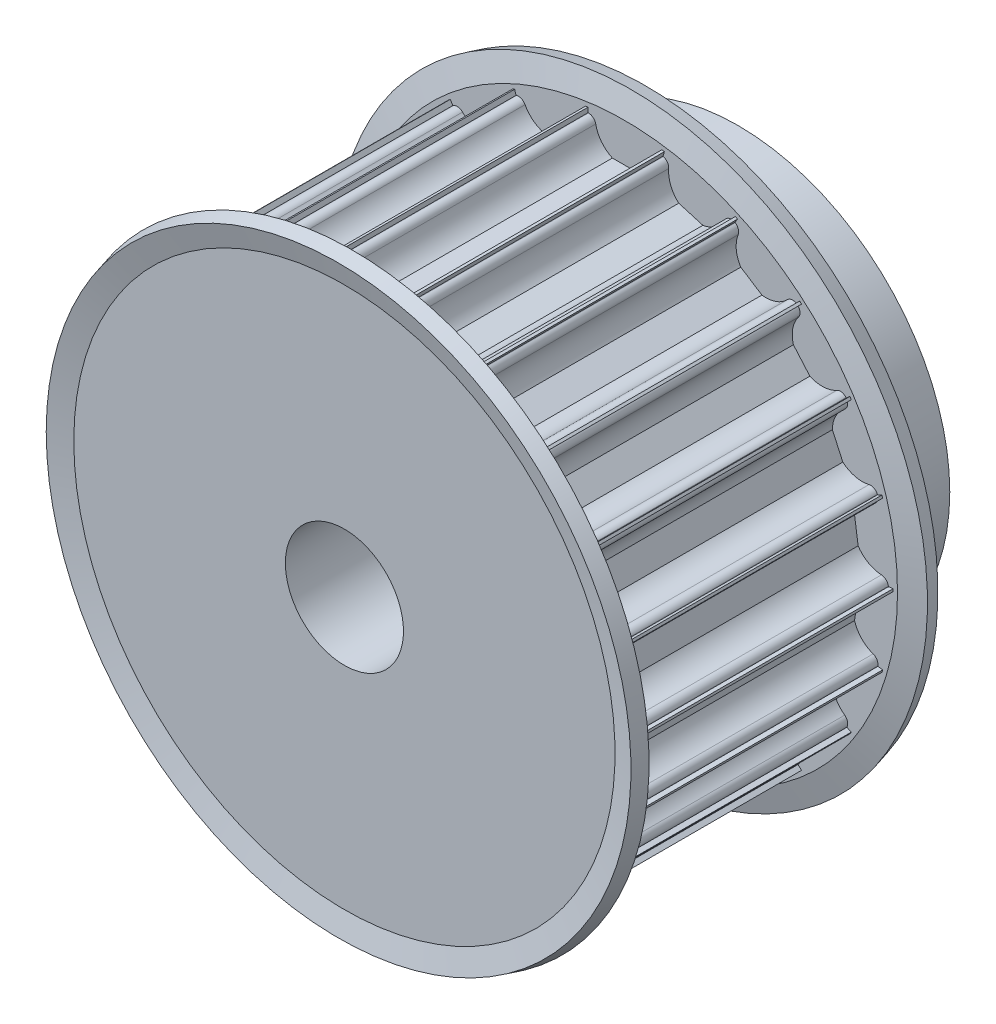
from build123d import *

# Parameters (mm, degrees)
CUT_EXTRUDE1_DEPTH = 48
CIRPATTERN1_COUNT  = 22


with BuildPart() as part:
    # Sketch1 → Revolve1 (revolve)
    with BuildSketch(Plane(origin=(0, 0, 0), x_dir=(0, 0, -1), z_dir=(1, 0, 0)), mode=Mode.PRIVATE) as revolve1_sk:
        Polygon((0, 6), (0, 27.25), (30, 27.25), (30, 21.5), (40, 21.5), (40, 6), align=None)
    revolve(revolve1_sk.sketch.rotate(Axis((0, 0, -88.99), (0, 0, 1)), 90), axis=Axis((0, 0, -88.99), (0, 0, 1)))

    # Sketch2 → Cut-Extrude1 (cut)
    with BuildSketch(Plane.XY):
        with BuildLine():
            Line((3.707104402, 26.5), (3.75, 26.5))
            Line((3.75, 26.5), (3.75, 28.5))
            Line((3.75, 28.5), (-3.75, 28.5))
            Line((-3.75, 28.5), (-3.75, 26.5))
            Line((-3.75, 26.5), (-3.707104402, 26.5))
            ThreePointArc((-3.707104402, 26.5), (-3.232258052, 26.33053505), (-2.97199787, 25.898722517))
            ThreePointArc((-2.97199787, 25.898722517), (-2.380891342, 24.622325275), (-1.277421604, 23.75))
            Line((-1.277421604, 23.75), (1.277421604, 23.75))
            ThreePointArc((1.277421604, 23.75), (2.380891342, 24.622325275), (2.97199787, 25.898722517))
            ThreePointArc((2.97199787, 25.898722517), (3.232258052, 26.33053505), (3.707104402, 26.5))
        make_face()
    cut_extrude1 = extrude(amount=-CUT_EXTRUDE1_DEPTH, mode=Mode.SUBTRACT)

    # CirPattern1: Cut-Extrude1 ×22 about axis
    cirpattern1_axis = Axis((0, 0, 0), (0, 0, 1))
    for i in range(1, CIRPATTERN1_COUNT):
        add(cut_extrude1.rotate(cirpattern1_axis, i * 360 / CIRPATTERN1_COUNT), mode=Mode.SUBTRACT)

    # Sketch3 → Revolve2 (revolve)
    with BuildSketch(Plane(origin=(0, 0, 0), x_dir=(0, 0, -1), z_dir=(1, 0, 0)), mode=Mode.PRIVATE) as revolve2_sk:
        Polygon((-0.591966801, 29.702510585), (0, 27.493260406), (0, 22.690739153), (1.5, 22.690739153), (1.5, 27.690739153), (0.856921938, 30.090739153), align=None)
        Polygon((30.591966801, 29.702510585), (29.143078062, 30.090739153), (28.5, 27.690739153), (28.5, 22.690739153), (30, 22.690739153), (30, 27.493260406), align=None)
    revolve(revolve2_sk.sketch.rotate(Axis((0, 0, -88.99), (0, 0, 1)), 90), axis=Axis((0, 0, -88.99), (0, 0, 1)))


solid = part.part
